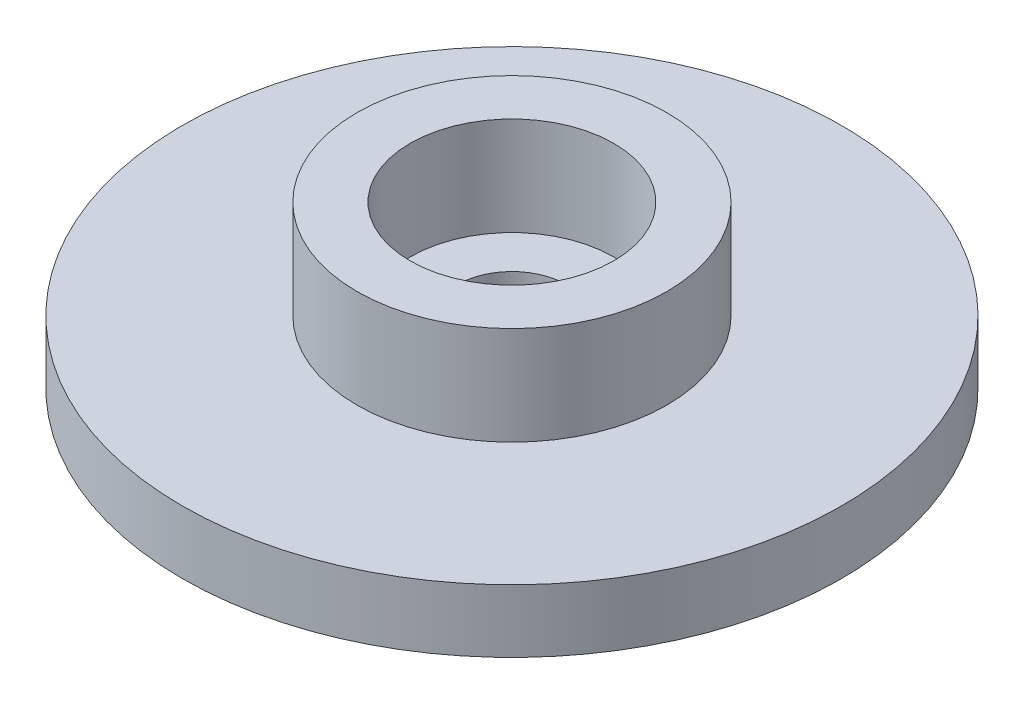
from build123d import *

# Parameters (mm, degrees)
SKETCH1_R           = 8.509
BOSS_EXTRUDE1_DEPTH = 1.6256
SKETCH2_R           = 4.0005
BOSS_EXTRUDE2_DEPTH = 2.54
SKETCH3_R           = 3.5179
BOSS_EXTRUDE3_DEPTH = 0.762
SKETCH4_R           = 3.0099
CUT_EXTRUDE1_DEPTH  = 0.762
SKETCH5_R           = 2.6289
CUT_EXTRUDE2_DEPTH  = 2.54
SKETCH6_R           = 1.397
CUT_EXTRUDE3_DEPTH  = 13.298689442


with BuildPart() as part:
    # Sketch1 → Boss-Extrude1 (new body)
    with BuildSketch(Plane(origin=(0, 0, 0), x_dir=(1, 0, 0), z_dir=(0, 1, 0))):
        with Locations(Location((0, 0, 0), (0, 0, 270))):
            Circle(SKETCH1_R)
    extrude(amount=BOSS_EXTRUDE1_DEPTH)

    # Sketch2 → Boss-Extrude2 (add)
    with BuildSketch(Plane(origin=(0, 1.6256, 0), x_dir=(1, 0, 0), z_dir=(0, 1, 0))):
        with Locations(Location((0, 0, 0), (0, 0, 270))):
            Circle(SKETCH2_R)
    extrude(amount=BOSS_EXTRUDE2_DEPTH)

    # Sketch3 → Boss-Extrude3 (add)
    with BuildSketch(Plane.XZ):
        with Locations(Location((0, 0, 0), (0, 0, 90))):
            Circle(SKETCH3_R)
    extrude(amount=BOSS_EXTRUDE3_DEPTH)

    # Sketch4 → Cut-Extrude1 (cut)
    with BuildSketch(Plane.XZ.offset(0.762)):
        with Locations(Location((0, 0, 0), (0, 0, 270))):
            Circle(SKETCH4_R)
    extrude(amount=-CUT_EXTRUDE1_DEPTH, mode=Mode.SUBTRACT)

    # Sketch5 → Cut-Extrude2 (cut)
    with BuildSketch(Plane(origin=(0, 4.1656, 0), x_dir=(1, 0, 0), z_dir=(0, 1, 0))):
        with Locations(Location((0, 0, 0), (0, 0, 270))):
            Circle(SKETCH5_R)
    extrude(amount=-CUT_EXTRUDE2_DEPTH, mode=Mode.SUBTRACT)

    # Sketch6 → Cut-Extrude3 (cut, through all)
    with BuildSketch(Plane(origin=(0, 1.6256, 0), x_dir=(1, 0, 0), z_dir=(0, 1, 0))):
        with Locations(Location((0, 0, 0), (0, 0, 270))):
            Circle(SKETCH6_R)
    extrude(amount=-CUT_EXTRUDE3_DEPTH, mode=Mode.SUBTRACT)


solid = part.part
